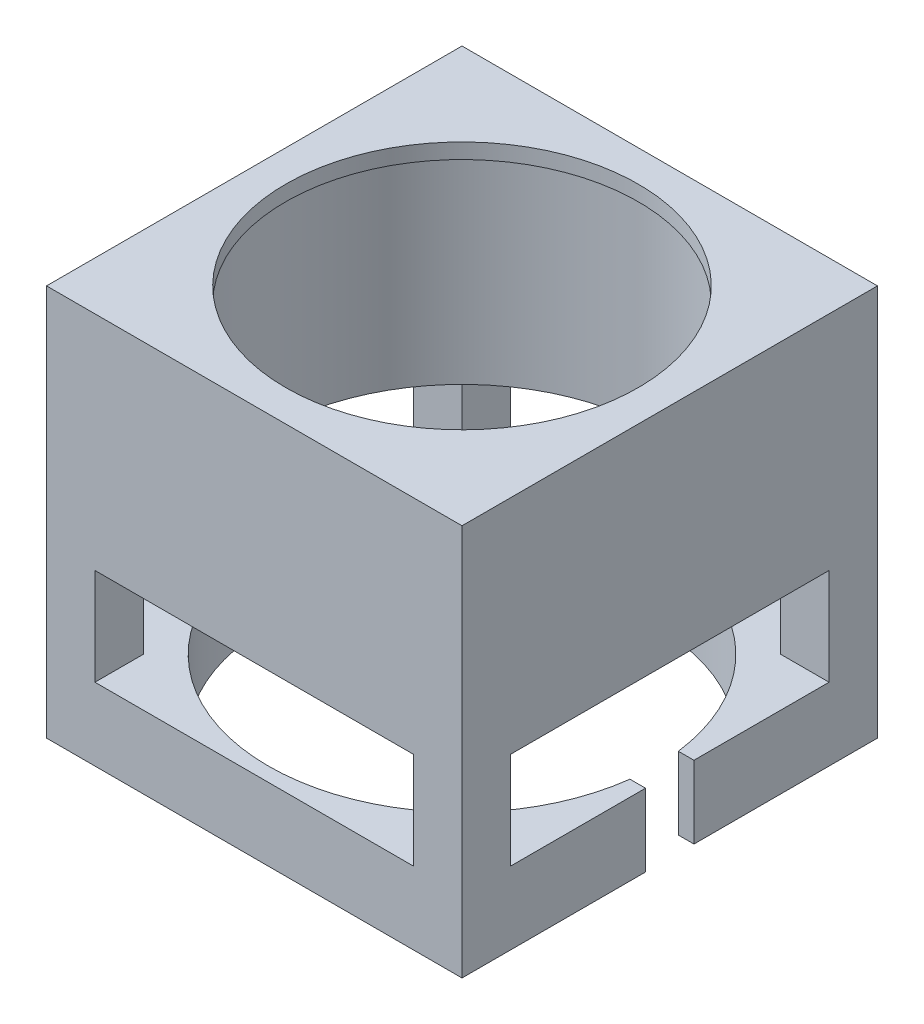
from build123d import *

# Parameters (mm, degrees)
SKETCH1_W           = 218
SKETCH1_H           = 218
SKETCH1_R           = 101.6
BOSS_EXTRUDE1_DEPTH = 38.1
SKETCH2_W           = 25.4
SKETCH2_H           = 25.4
BOSS_EXTRUDE2_DEPTH = 50.8
SKETCH3_W           = 218
SKETCH3_H           = 218
SKETCH3_R           = 101.6
BOSS_EXTRUDE3_DEPTH = 108.6
SKETCH4_W           = 218
SKETCH4_H           = 218
SKETCH4_R           = 92.5
BOSS_EXTRUDE4_DEPTH = 8
CUT_EXTRUDE1_REACH  = 258.89
SKETCH5_W           = 16.393750096
SKETCH5_H           = 25.4


with BuildPart() as part:
    # Sketch1 → Boss-Extrude1 (new body)
    with BuildSketch(Plane(origin=(0, 0, 0), x_dir=(1, 0, 0), z_dir=(0, 1, 0))):
        Rectangle(SKETCH1_W, SKETCH1_H)
        with Locations(Location((0, 0, 0), (0, 0, 90))):
            Circle(SKETCH1_R, mode=Mode.SUBTRACT)
    extrude(amount=BOSS_EXTRUDE1_DEPTH)

    # Sketch2 → Boss-Extrude2 (add)
    with BuildSketch(Plane(origin=(0, 38.1, 0), x_dir=(1, 0, 0), z_dir=(0, 1, 0))):
        with Locations((-96.3, 96.3)):
            Rectangle(SKETCH2_W, SKETCH2_H)
        with Locations((96.3, 96.3)):
            Rectangle(SKETCH2_W, SKETCH2_H)
        with Locations((96.3, -96.3)):
            Rectangle(SKETCH2_W, SKETCH2_H)
        with Locations((-96.3, -96.3)):
            Rectangle(SKETCH2_W, SKETCH2_H)
    extrude(amount=BOSS_EXTRUDE2_DEPTH)

    # Sketch3 → Boss-Extrude3 (add)
    with BuildSketch(Plane(origin=(0, 88.9, 0), x_dir=(1, 0, 0), z_dir=(0, 1, 0))):
        Rectangle(SKETCH3_W, SKETCH3_H)
        with Locations(Location((0, 0, 0), (0, 0, 90))):
            Circle(SKETCH3_R, mode=Mode.SUBTRACT)
    extrude(amount=BOSS_EXTRUDE3_DEPTH)

    # Sketch4 → Boss-Extrude4 (add)
    with BuildSketch(Plane(origin=(0, 197.5, 0), x_dir=(1, 0, 0), z_dir=(0, 1, 0))):
        Rectangle(SKETCH4_W, SKETCH4_H)
        with Locations(Location((0, 0, 0), (0, 0, 270))):
            Circle(SKETCH4_R, mode=Mode.SUBTRACT)
    extrude(amount=BOSS_EXTRUDE4_DEPTH)

    # Sketch5 → Cut-Extrude1 (cut, up to next)
    with BuildSketch(Plane.XZ, mode=Mode.PRIVATE) as cut_extrude1_sk1:
        with Locations((109, 0)):
            Rectangle(SKETCH5_W, SKETCH5_H)
    cut_extrude1_tool1 = extrude(cut_extrude1_sk1.sketch, amount=-CUT_EXTRUDE1_REACH, mode=Mode.PRIVATE) & part.part
    add(cut_extrude1_tool1.solids().sort_by_distance((109, 0, 0))[0], mode=Mode.SUBTRACT)


solid = part.part
